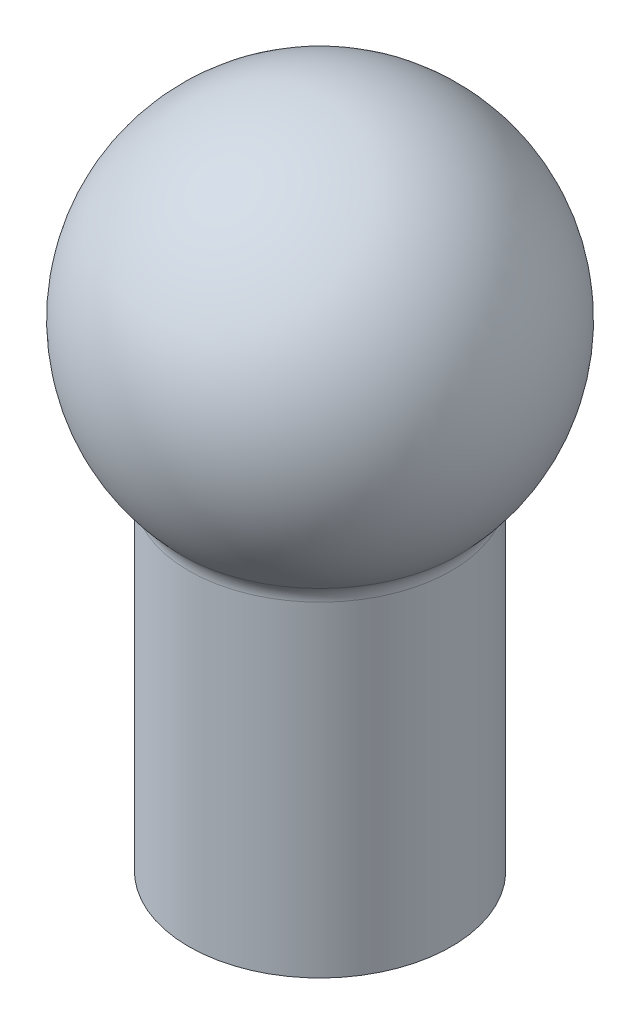
from build123d import *

# Parameters (mm, degrees)
FILLET1_R = 1


with BuildPart() as part:
    # Sketch1 → Revolve1 (revolve)
    with BuildSketch(Plane.XY):
        with BuildLine():
            ThreePointArc((0, 8.1), (-7.542415486, 2.953297924), (-5.5, -5.946427499))
            Line((-5.5, -5.946427499), (-5.5, -20))
            Line((-5.5, -20), (0, -20))
            Line((0, -20), (0, 8.1))
        make_face()
    revolve(axis=Axis((0, 0, 0), (0, 1, 0)))

    # Fillet1
    fillet1_edges = [part.edges().sort_by_distance(p)[0] for p in [
        (5.5, -5.946427499, 0),
    ]]
    fillet(fillet1_edges, radius=FILLET1_R)


solid = part.part
